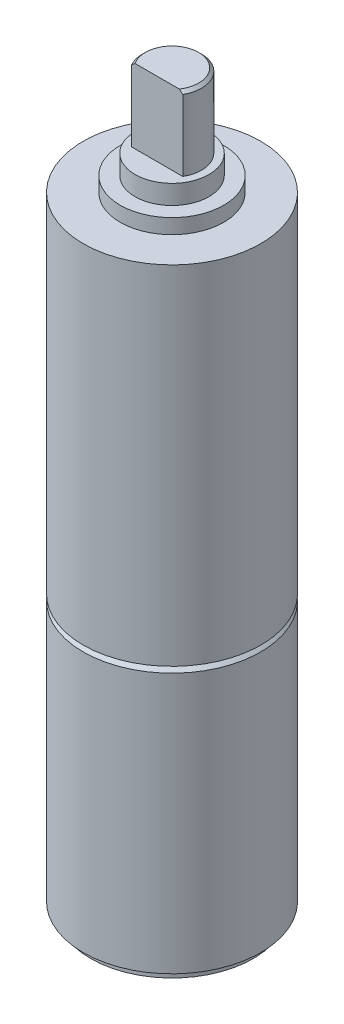
from build123d import *

# Parameters (mm, degrees)
SKETCH_1_R          = 2.75
EXTRUDE_1_DEPTH     = 0.3
EXTRUDE_START       = 0.3
SKETCH_2_R          = 3
EXTRUDE_2_DEPTH     = 9
CHAMFER_1_SIZE      = 0.2
EXTRUDE_START_2     = 9.3
SKETCH_3_R          = 3
EXTRUDE_3_DEPTH     = 11.75
EXTRUDE_START_3     = 21.05
SKETCH_4_R          = 1.75
EXTRUDE_4_DEPTH     = 0.5
SKETCH_5_R          = 1.25
EXTRUDE_5_DEPTH     = 1.15
SKETCH_6_R          = 1
EXTRUDE_6_DEPTH     = 3.65
CUT_EXTRUDE_START   = 22.2
CUT_EXTRUDE_1_DEPTH = 2.5
CHAMFER_2_SIZE      = 0.1


with BuildPart() as part:
    # 草图1 → 凸台-拉伸1 (new body)
    with BuildSketch(Plane(origin=(0, 0, 0), x_dir=(1, 0, 0), z_dir=(0, 1, 0))):
        with Locations(Location((0, 0, 0), (0, 0, 270))):
            Circle(SKETCH_1_R)
    extrude(amount=EXTRUDE_1_DEPTH)

    # 草图2 → 凸台-拉伸2 (add)
    with BuildSketch(Plane(origin=(0, 0, 0), x_dir=(1, 0, 0), z_dir=(0, 1, 0)).offset(EXTRUDE_START)):
        with Locations(Location((0, 0, 0), (0, 0, 270))):
            Circle(SKETCH_2_R)
    extrude(amount=EXTRUDE_2_DEPTH)

    # 倒角1
    chamfer_1_edges = [part.edges().sort_by_distance(p)[0] for p in [
        (0, 9.3, -3),
    ]]
    chamfer(chamfer_1_edges, length=CHAMFER_1_SIZE)

    # 草图3 → 凸台-拉伸3 (add)
    with BuildSketch(Plane(origin=(0, 0, 0), x_dir=(1, 0, 0), z_dir=(0, 1, 0)).offset(EXTRUDE_START_2)):
        with Locations(Location((0, 0, 0), (0, 0, 270))):
            Circle(SKETCH_3_R)
    extrude(amount=EXTRUDE_3_DEPTH)

    # 草图4 → 凸台-拉伸4 (add)
    with BuildSketch(Plane(origin=(0, 0, 0), x_dir=(1, 0, 0), z_dir=(0, 1, 0)).offset(EXTRUDE_START_3)):
        with Locations(Location((0, 0, 0), (0, 0, 270))):
            Circle(SKETCH_4_R)
    extrude(amount=EXTRUDE_4_DEPTH)

    # 草图5 → 凸台-拉伸5 (add)
    with BuildSketch(Plane(origin=(0, 0, 0), x_dir=(1, 0, 0), z_dir=(0, 1, 0)).offset(EXTRUDE_START_3)):
        with Locations(Location((0, 0, 0), (0, 0, 270))):
            Circle(SKETCH_5_R)
    extrude(amount=EXTRUDE_5_DEPTH)

    # 草图6 → 凸台-拉伸6 (add)
    with BuildSketch(Plane(origin=(0, 0, 0), x_dir=(1, 0, 0), z_dir=(0, 1, 0)).offset(EXTRUDE_START_3)):
        with Locations(Location((0, 0, 0), (0, 0, 270))):
            Circle(SKETCH_6_R)
    extrude(amount=EXTRUDE_6_DEPTH)

    # 草图7 → 切除-拉伸1 (cut)
    with BuildSketch(Plane(origin=(0, 0, 0), x_dir=(1, 0, 0), z_dir=(0, 1, 0)).offset(CUT_EXTRUDE_START)):
        with BuildLine():
            Line((-0.866025404, -0.5), (0.866025404, -0.5))
            ThreePointArc((0.866025404, -0.5), (0, -1), (-0.866025404, -0.5))
        make_face()
    extrude(amount=CUT_EXTRUDE_1_DEPTH, mode=Mode.SUBTRACT)

    # 倒角2
    chamfer_2_edges = [part.edges().sort_by_distance(p)[0] for p in [
        (0, 24.7, -1),
    ]]
    chamfer(chamfer_2_edges, length=CHAMFER_2_SIZE)


solid = part.part
